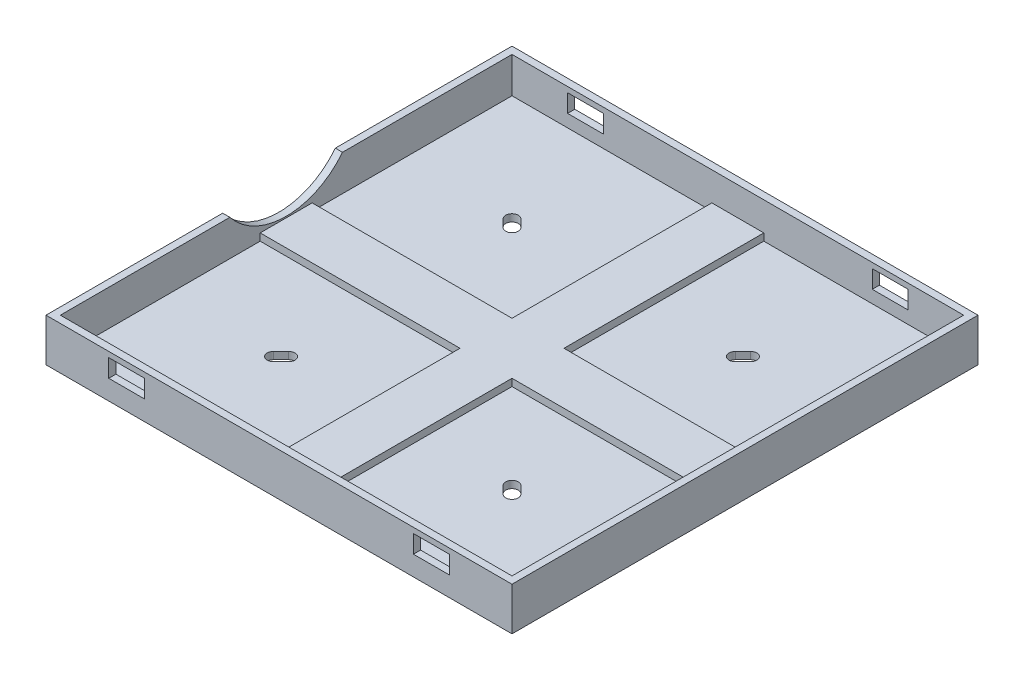
from build123d import *

# Parameters (mm, degrees)
SKETCH1_W           = 260
SKETCH1_H           = 260
BOSS_EXTRUDE1_DEPTH = 24
SKETCH2_W           = 252
SKETCH2_H           = 252
CUT_EXTRUDE1_DEPTH  = 16
SKETCH3_W           = 111.5
SKETCH3_H           = 111.5
CUT_EXTRUDE2_DEPTH  = 4
SKETCH4_W           = 111.5
SKETCH4_H           = 111.5
CUT_EXTRUDE3_DEPTH  = 4
SKETCH5_W           = 111.5
SKETCH5_H           = 111.5
CUT_EXTRUDE4_DEPTH  = 4
SKETCH6_W           = 111.5
SKETCH6_H           = 111.5
CUT_EXTRUDE5_DEPTH  = 4
CUT_EXTRUDE6_DEPTH  = 295.911587107
SKETCH8_W           = 20
SKETCH8_H           = 10
CUT_EXTRUDE7_DEPTH  = 334.972898877
CUT_EXTRUDE8_DEPTH  = 260.495566311
CUT_EXTRUDE9_DEPTH  = 260.495566311
CUT_EXTRUDE10_REACH = 339.049
SKETCH11_W          = 20
SKETCH11_H          = 10
SKETCH12_W          = 20
SKETCH12_H          = 10
CUT_EXTRUDE11_DEPTH = 334.972898877
CUT_EXTRUDE12_DEPTH = 260.495566311
SKETCH14_W          = 20
SKETCH14_H          = 10
CUT_EXTRUDE13_DEPTH = 334.972898877
CUT_EXTRUDE14_DEPTH = 260.834464487


with BuildPart() as part:
    # Sketch1 → Boss-Extrude1 (new body)
    with BuildSketch(Plane(origin=(0, 15.823913221, 0), x_dir=(1, 0, 0), z_dir=(0, 1, 0))):
        with Locations((-83.896005, -15.555652519)):
            Rectangle(SKETCH1_W, SKETCH1_H)
    extrude(amount=-BOSS_EXTRUDE1_DEPTH)

    # Sketch2 → Cut-Extrude1 (cut)
    with BuildSketch(Plane(origin=(0, 15.823913221, 0), x_dir=(-1, 0, 0), z_dir=(0, 1, 0))):
        with Locations((83.896005, 15.555652519)):
            Rectangle(SKETCH2_W, SKETCH2_H)
    extrude(amount=-CUT_EXTRUDE1_DEPTH, mode=Mode.SUBTRACT)

    # Sketch3 → Cut-Extrude2 (cut)
    with BuildSketch(Plane(origin=(0, -0.176086779, 0), x_dir=(-1, 0, 0), z_dir=(0, 1, 0))):
        with Locations((13.646005, 85.805652519)):
            Rectangle(SKETCH3_W, SKETCH3_H)
    extrude(amount=-CUT_EXTRUDE2_DEPTH, mode=Mode.SUBTRACT)

    # Sketch4 → Cut-Extrude3 (cut)
    with BuildSketch(Plane(origin=(0, -0.176086779, 0), x_dir=(-1, 0, 0), z_dir=(0, 1, 0))):
        with Locations((154.146005, 85.805652519)):
            Rectangle(SKETCH4_W, SKETCH4_H)
    extrude(amount=-CUT_EXTRUDE3_DEPTH, mode=Mode.SUBTRACT)

    # Sketch5 → Cut-Extrude4 (cut)
    with BuildSketch(Plane(origin=(0, -0.176086779, 0), x_dir=(-1, 0, 0), z_dir=(0, 1, 0))):
        with Locations((154.146005, -54.694347481)):
            Rectangle(SKETCH5_W, SKETCH5_H)
    extrude(amount=-CUT_EXTRUDE4_DEPTH, mode=Mode.SUBTRACT)

    # Sketch6 → Cut-Extrude5 (cut)
    with BuildSketch(Plane(origin=(0, -0.176086779, 0), x_dir=(-1, 0, 0), z_dir=(0, 1, 0))):
        with Locations((13.646005, -54.694347481)):
            Rectangle(SKETCH6_W, SKETCH6_H)
    extrude(amount=-CUT_EXTRUDE5_DEPTH, mode=Mode.SUBTRACT)

    # Sketch7 → Cut-Extrude6 (cut, through all)
    with BuildSketch(Plane(origin=(-209.896005, 0, 0), x_dir=(0, 0, -1), z_dir=(1, 0, 0))):
        with BuildLine():
            Line((15.867865744, 15.823913221), (-46.979170782, 15.823913221))
            ThreePointArc((-46.979170782, 15.823913221), (-15.555652519, 0.573913221), (15.867865744, 15.823913221))
        make_face()
    extrude(amount=-CUT_EXTRUDE6_DEPTH, mode=Mode.SUBTRACT)

    # Sketch8 → Cut-Extrude7 (cut, through all)
    with BuildSketch(Plane(origin=(0, 0, 141.555652519), x_dir=(-1, 0, 0), z_dir=(0, 0, -1))):
        with Locations((168.896005, 7.823913221)):
            Rectangle(SKETCH8_W, SKETCH8_H)
    extrude(amount=-CUT_EXTRUDE7_DEPTH, mode=Mode.SUBTRACT)

    # Sketch9 → Cut-Extrude8 (cut, through all)
    with BuildSketch(Plane(origin=(0, -4.176086779, 0), x_dir=(-1, 0, 0), z_dir=(0, 1, 0))):
        with BuildLine():
            Line((24.071888861, 80.329516126), (19.829248174, 84.572156814))
            ThreePointArc((19.829248174, 84.572156814), (14.879500705, 84.572156814), (14.879500705, 79.622409345))
            Line((14.879500705, 79.622409345), (19.122141392, 75.379768658))
            ThreePointArc((19.122141392, 75.379768658), (24.071888861, 75.379768658), (24.071888861, 80.329516126))
        make_face()
    extrude(amount=-CUT_EXTRUDE8_DEPTH, mode=Mode.SUBTRACT)

    # Sketch10 → Cut-Extrude9 (cut, through all)
    with BuildSketch(Plane(origin=(0, -4.176086779, 0), x_dir=(-1, 0, 0), z_dir=(0, 1, 0))):
        with BuildLine():
            Line((147.962761826, 84.572156814), (143.720121139, 80.329516126))
            ThreePointArc((143.720121139, 80.329516126), (143.720121139, 75.379768658), (148.669868607, 75.379768658))
            Line((148.669868607, 75.379768658), (152.912509294, 79.622409345))
            ThreePointArc((152.912509294, 79.622409345), (152.912509294, 84.572156814), (147.962761826, 84.572156814))
        make_face()
    extrude(amount=-CUT_EXTRUDE9_DEPTH, mode=Mode.SUBTRACT)

    # Sketch11 → Cut-Extrude10 (cut, up to next)
    with BuildSketch(Plane.XY.offset(145.555652519), mode=Mode.PRIVATE) as cut_extrude10_sk1:
        with Locations((1.103995, 7.823913221)):
            Rectangle(SKETCH11_W, SKETCH11_H)
    cut_extrude10_tool1 = extrude(cut_extrude10_sk1.sketch, amount=-CUT_EXTRUDE10_REACH, mode=Mode.PRIVATE) & part.part
    add(cut_extrude10_tool1.solids().sort_by_distance((1.103995, 7.823913, 145.555653))[0], mode=Mode.SUBTRACT)

    # Sketch12 → Cut-Extrude11 (cut, through all)
    with BuildSketch(Plane.XY.offset(-110.444347481)):
        with Locations((-168.896005, 7.823913221)):
            Rectangle(SKETCH12_W, SKETCH12_H)
    extrude(amount=-CUT_EXTRUDE11_DEPTH, mode=Mode.SUBTRACT)

    # Sketch13 → Cut-Extrude12 (cut, through all)
    with BuildSketch(Plane(origin=(0, -4.176086779, 0), x_dir=(-1, 0, 0), z_dir=(0, 1, 0))):
        with BuildLine():
            Line((19.829248174, -53.460851775), (24.071888861, -49.218211088))
            ThreePointArc((24.071888861, -49.218211088), (24.071888861, -44.26846362), (19.122141392, -44.26846362))
            Line((19.122141392, -44.26846362), (14.879500705, -48.511104307))
            ThreePointArc((14.879500705, -48.511104307), (14.879500705, -53.460851775), (19.829248174, -53.460851775))
        make_face()
    extrude(amount=-CUT_EXTRUDE12_DEPTH, mode=Mode.SUBTRACT)

    # Sketch14 → Cut-Extrude13 (cut, through all)
    with BuildSketch(Plane.XY.offset(-110.444347481)):
        with Locations((1.103995, 7.823913221)):
            Rectangle(SKETCH14_W, SKETCH14_H)
    extrude(amount=-CUT_EXTRUDE13_DEPTH, mode=Mode.SUBTRACT)

    # Sketch15 → Cut-Extrude14 (cut, through all)
    with BuildSketch(Plane.XZ.offset(8.176086779)):
        with BuildLine():
            Line((-148.669868607, -44.26846362), (-152.912509294, -48.511104307))
            ThreePointArc((-152.912509294, -48.511104307), (-152.912509294, -53.460851775), (-147.962761826, -53.460851775))
            Line((-147.962761826, -53.460851775), (-143.720121139, -49.218211088))
            ThreePointArc((-143.720121139, -49.218211088), (-143.720121139, -44.26846362), (-148.669868607, -44.26846362))
        make_face()
    extrude(amount=-CUT_EXTRUDE14_DEPTH, mode=Mode.SUBTRACT)


solid = part.part
